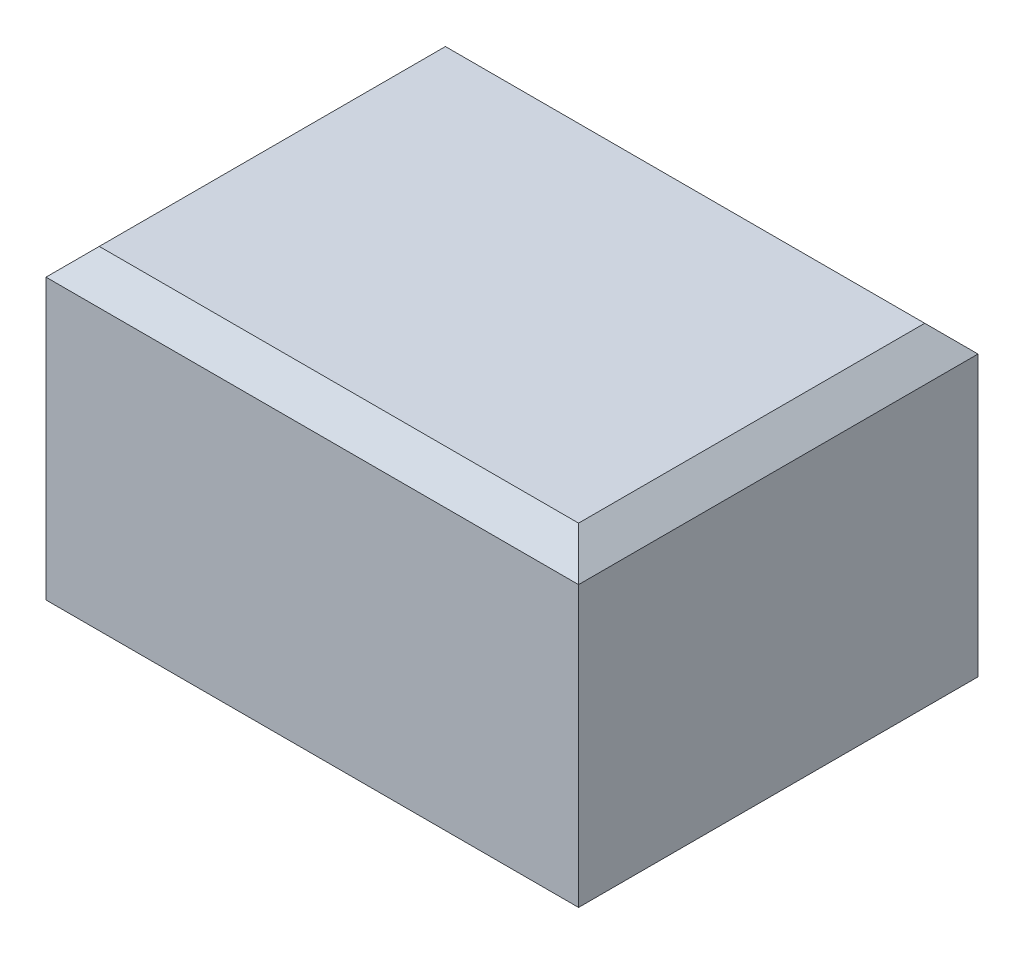
from build123d import *

# Parameters (mm, degrees)
SKETCH1_W           = 400
SKETCH1_H           = 300
BOSS_EXTRUDE1_DEPTH = 250
CHAMFER1_SIZE       = 20


with BuildPart() as part:
    # Sketch1 → Boss-Extrude1 (new body)
    with BuildSketch(Plane(origin=(0, 0, 0), x_dir=(1, 0, 0), z_dir=(0, 1, 0))):
        Rectangle(SKETCH1_W, SKETCH1_H)
    extrude(amount=BOSS_EXTRUDE1_DEPTH)

    # Chamfer1
    chamfer1_edges = [part.edges().sort_by_distance(p)[0] for p in [
        (-200, 250, 0),
        (0, 250, 150),
        (200, 250, 0),
        (0, 0, 150),
        (-200, 0, 0),
        (0, 0, -150),
        (200, 0, 0),
        (0, 250, -150),
    ]]
    chamfer(chamfer1_edges, length=CHAMFER1_SIZE)


solid = part.part
